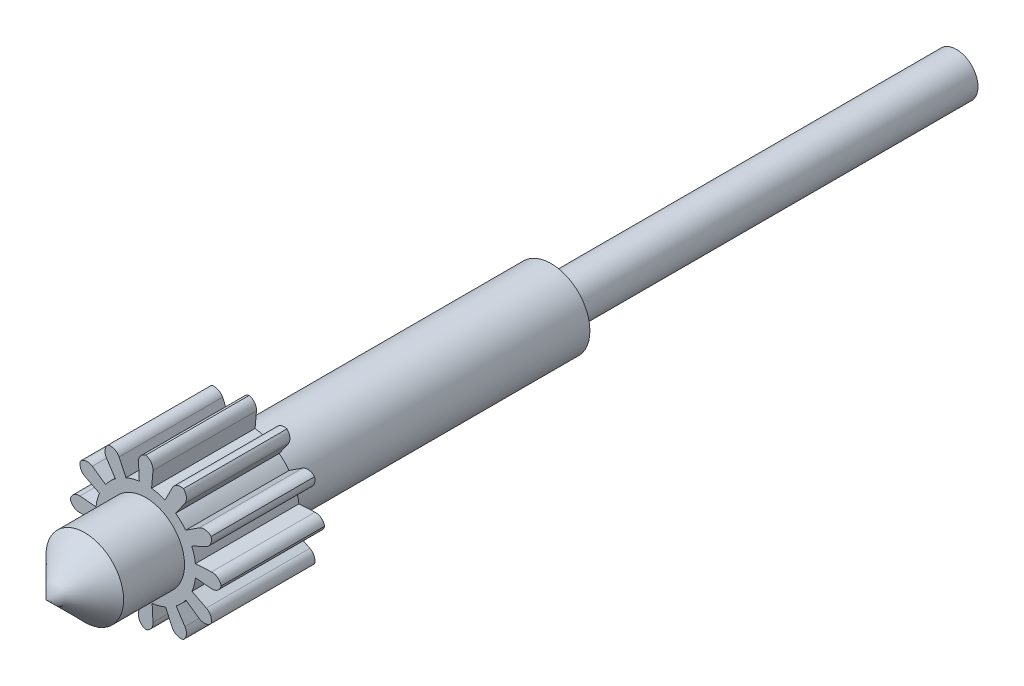
from build123d import *

# Parameters (mm, degrees)
SKETCH1_R                = 0.9
BOSS_EXTRUDE3_DEPTH      = 2.4
BOSS_EXTRUDE4_DEPTH      = 4.7124
BOSS_EXTRUDE4_DEPTH_BACK = 7
SKETCH1_4_R              = 0.9
SKETCH2_R                = 0.5
BOSS_EXTRUDE5_DEPTH      = 9.4
CHAMFER1_SIZE            = 0.9


with BuildPart() as part:
    # Sketch1 → Boss-Extrude3 (new body)
    with BuildSketch(Plane.XY):
        with BuildLine():
            Line((-0.168494904, 1.525812496), (-0.14853508, 1.15297163))
            ThreePointArc((-0.14853508, 1.15297163), (-0.307014366, 1.121226306), (-0.459558891, 1.067807041))
            Line((-0.459558891, 1.067807041), (-0.616985381, 1.405639835))
            ThreePointArc((-0.616985381, 1.405639835), (-0.725995936, 1.507536988), (-0.875, 1.515544457))
            ThreePointArc((-0.875, 1.515544457), (-0.942567361, 1.382499417), (-0.908827115, 1.237144931))
            Line((-0.908827115, 1.237144931), (-0.705120968, 0.924235181))
            ThreePointArc((-0.705120968, 0.924235181), (-0.826495394, 0.817503281), (-0.931893194, 0.694968578))
            Line((-0.931893194, 0.694968578), (-1.237144931, 0.908827115))
            ThreePointArc((-1.237144931, 0.908827115), (-1.382499417, 0.942567361), (-1.515544457, 0.875))
            ThreePointArc((-1.515544457, 0.875), (-1.507536988, 0.725995936), (-1.405639835, 0.616985381))
            Line((-1.405639835, 0.616985381), (-1.072770262, 0.447850662))
            ThreePointArc((-1.072770262, 0.447850662), (-1.124517647, 0.294730912), (-1.154527469, 0.135913846))
            Line((-1.154527469, 0.135913846), (-1.525812496, 0.168494904))
            ThreePointArc((-1.525812496, 0.168494904), (-1.668563296, 0.125037571), (-1.75, 0))
            ThreePointArc((-1.75, 0), (-1.668563296, -0.125037571), (-1.525812496, -0.168494904))
            Line((-1.525812496, -0.168494904), (-1.15297163, -0.14853508))
            ThreePointArc((-1.15297163, -0.14853508), (-1.121226306, -0.307014366), (-1.067807041, -0.459558891))
            Line((-1.067807041, -0.459558891), (-1.405639835, -0.616985381))
            ThreePointArc((-1.405639835, -0.616985381), (-1.507536988, -0.725995936), (-1.515544457, -0.875))
            ThreePointArc((-1.515544457, -0.875), (-1.382499417, -0.942567361), (-1.237144931, -0.908827115))
            Line((-1.237144931, -0.908827115), (-0.924235181, -0.705120968))
            ThreePointArc((-0.924235181, -0.705120968), (-0.817503281, -0.826495394), (-0.694968578, -0.931893194))
            Line((-0.694968578, -0.931893194), (-0.908827115, -1.237144931))
            ThreePointArc((-0.908827115, -1.237144931), (-0.942567361, -1.382499417), (-0.875, -1.515544457))
            ThreePointArc((-0.875, -1.515544457), (-0.725995936, -1.507536988), (-0.616985381, -1.405639835))
            Line((-0.616985381, -1.405639835), (-0.447850662, -1.072770262))
            ThreePointArc((-0.447850662, -1.072770262), (-0.294730912, -1.124517647), (-0.135913846, -1.154527469))
            Line((-0.135913846, -1.154527469), (-0.168494904, -1.525812496))
            ThreePointArc((-0.168494904, -1.525812496), (-0.125037571, -1.668563296), (0, -1.75))
            ThreePointArc((0, -1.75), (0.125037571, -1.668563296), (0.168494904, -1.525812496))
            Line((0.168494904, -1.525812496), (0.14853508, -1.15297163))
            ThreePointArc((0.14853508, -1.15297163), (0.307014366, -1.121226306), (0.459558891, -1.067807041))
            Line((0.459558891, -1.067807041), (0.616985381, -1.405639835))
            ThreePointArc((0.616985381, -1.405639835), (0.725995936, -1.507536988), (0.875, -1.515544457))
            ThreePointArc((0.875, -1.515544457), (0.942567361, -1.382499417), (0.908827115, -1.237144931))
            Line((0.908827115, -1.237144931), (0.705120968, -0.924235181))
            ThreePointArc((0.705120968, -0.924235181), (0.826495394, -0.817503281), (0.931893194, -0.694968578))
            Line((0.931893194, -0.694968578), (1.237144931, -0.908827115))
            ThreePointArc((1.237144931, -0.908827115), (1.382499417, -0.942567361), (1.515544457, -0.875))
            ThreePointArc((1.515544457, -0.875), (1.507536988, -0.725995936), (1.405639835, -0.616985381))
            Line((1.405639835, -0.616985381), (1.072770262, -0.447850662))
            ThreePointArc((1.072770262, -0.447850662), (1.124517647, -0.294730912), (1.154527469, -0.135913846))
            Line((1.154527469, -0.135913846), (1.525812496, -0.168494904))
            ThreePointArc((1.525812496, -0.168494904), (1.668563296, -0.125037571), (1.75, 0))
            ThreePointArc((1.75, 0), (1.668563296, 0.125037571), (1.525812496, 0.168494904))
            Line((1.525812496, 0.168494904), (1.15297163, 0.14853508))
            ThreePointArc((1.15297163, 0.14853508), (1.121226306, 0.307014366), (1.067807041, 0.459558891))
            Line((1.067807041, 0.459558891), (1.405639835, 0.616985381))
            ThreePointArc((1.405639835, 0.616985381), (1.507536988, 0.725995936), (1.515544457, 0.875))
            ThreePointArc((1.515544457, 0.875), (1.382499417, 0.942567361), (1.237144931, 0.908827115))
            Line((1.237144931, 0.908827115), (0.924235181, 0.705120968))
            ThreePointArc((0.924235181, 0.705120968), (0.817503281, 0.826495394), (0.694968578, 0.931893194))
            Line((0.694968578, 0.931893194), (0.908827115, 1.237144931))
            ThreePointArc((0.908827115, 1.237144931), (0.942567361, 1.382499417), (0.875, 1.515544457))
            ThreePointArc((0.875, 1.515544457), (0.725995936, 1.507536988), (0.616985381, 1.405639835))
            Line((0.616985381, 1.405639835), (0.447850662, 1.072770262))
            ThreePointArc((0.447850662, 1.072770262), (0.294730912, 1.124517647), (0.135913846, 1.154527469))
            Line((0.135913846, 1.154527469), (0.168494904, 1.525812496))
            ThreePointArc((0.168494904, 1.525812496), (0.125037571, 1.668563296), (0, 1.75))
            ThreePointArc((0, 1.75), (-0.125037571, 1.668563296), (-0.168494904, 1.525812496))
        make_face()
        Circle(SKETCH1_R, mode=Mode.SUBTRACT)
    extrude(amount=BOSS_EXTRUDE3_DEPTH)

    # Sketch1<4> → Boss-Extrude4 (add, two sides: drawn at the far end of the back side and taken through both)
    with BuildSketch(Plane.XY.offset(-BOSS_EXTRUDE4_DEPTH_BACK)):
        Circle(SKETCH1_4_R)
    extrude(amount=BOSS_EXTRUDE4_DEPTH + BOSS_EXTRUDE4_DEPTH_BACK)

    # Sketch2 → Boss-Extrude5 (add)
    with BuildSketch(Plane(origin=(0, 0, -7), x_dir=(-1, 0, 0), z_dir=(0, 0, -1))):
        Circle(SKETCH2_R)
    extrude(amount=BOSS_EXTRUDE5_DEPTH)

    # Chamfer1
    chamfer1_edges = [part.edges().sort_by_distance(p)[0] for p in [
        (-0.9, 0, 4.7124),
    ]]
    chamfer(chamfer1_edges, length=CHAMFER1_SIZE)


solid = part.part
